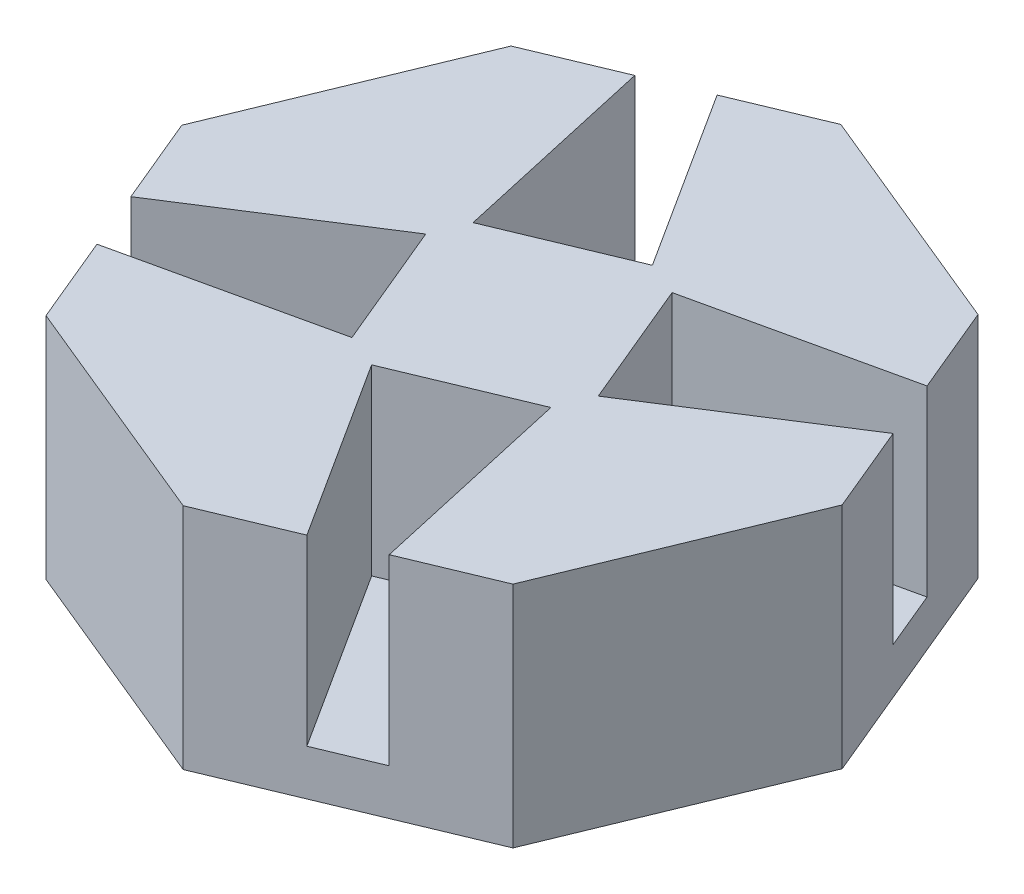
from build123d import *

# Parameters (mm, degrees)
BOSS_EXTRUDE1_DEPTH = 38.1
CUT_EXTRUDE1_DEPTH  = 30.48


with BuildPart() as part:
    # Sketch1 → Boss-Extrude1 (new body)
    with BuildSketch(Plane(origin=(0, 0, 0), x_dir=(1, 0, 0), z_dir=(0, 1, 0))):
        Polygon((-0.111992667, 54.937923296), (-38.926168882, 38.767787333), (-54.937923296, -0.111992667), (-38.767787333, -38.926168882), (0.111992667, -54.937923296), (38.926168882, -38.767787333), (54.937923296, 0.111992667), (38.767787333, 38.926168882), align=None)
    extrude(amount=BOSS_EXTRUDE1_DEPTH)

    # Sketch2 → Cut-Extrude1 (cut)
    with BuildSketch(Plane(origin=(0, 38.1, 0), x_dir=(1, 0, 0), z_dir=(0, 1, 0))):
        Polygon((16.590278128, -10.100852389), (-4.511730777, -18.892030932), (14.673385048, -48.8715909), (24.364776501, -44.834119729), align=None)
        Polygon((-10.100852389, -16.590278128), (-18.892030932, 4.511730777), (-48.8715909, -14.673385048), (-44.834119729, -24.364776501), align=None)
        Polygon((-16.590278128, 10.100852389), (4.511730777, 18.892030932), (-14.673385048, 48.8715909), (-24.364776501, 44.834119729), align=None)
        Polygon((10.100852389, 16.590278128), (18.892030932, -4.511730777), (48.8715909, 14.673385048), (44.834119729, 24.364776501), align=None)
    extrude(amount=-CUT_EXTRUDE1_DEPTH, mode=Mode.SUBTRACT)


solid = part.part
